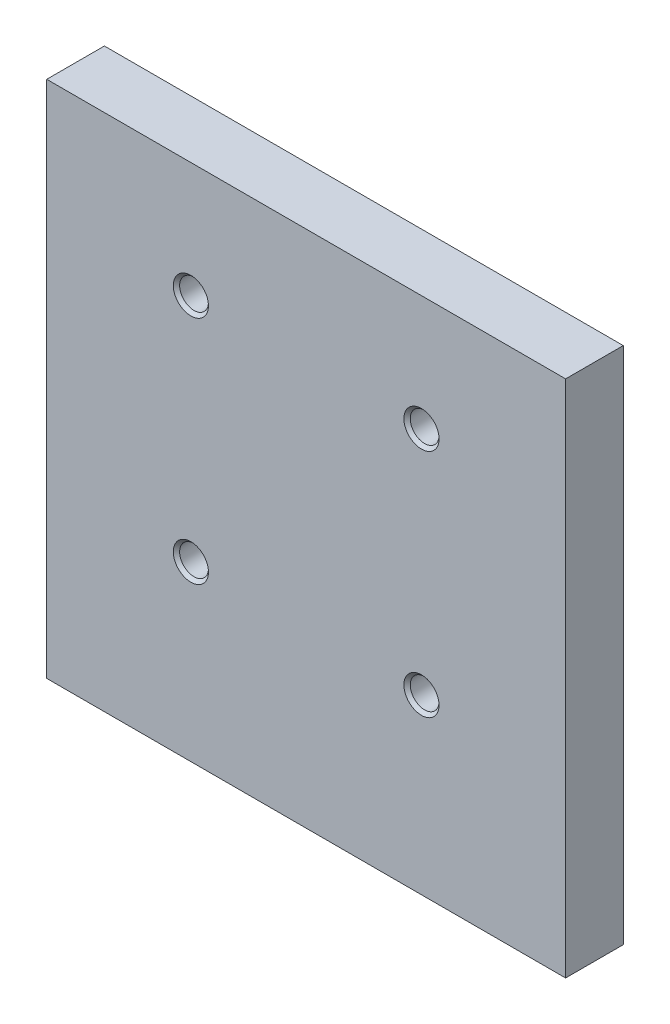
from build123d import *

# Parameters (mm, degrees)
SKETCH_1_W                   = 45
SKETCH_1_H                   = 45
EXTRUDE_1_DEPTH              = 5
HOLE_WIZARD_M3_3_D           = 2.5
HOLE_WIZARD_M3_3_CSINK_D     = 3.05
HOLE_WIZARD_M3_3_CSINK_ANGLE = 90


with BuildPart() as part:
    # 草图1 → 凸台-拉伸1 (new body)
    with BuildSketch(Plane.XY):
        with Locations((22.5, 22.5)):
            Rectangle(SKETCH_1_W, SKETCH_1_H)
    extrude(amount=EXTRUDE_1_DEPTH)

    # M3 螺纹孔3 (through all)
    with Locations(Plane.XY.offset(5)):
        with Locations((12.5, 35), (32.5, 35), (32.5, 15), (12.5, 15)):
            CounterSinkHole(HOLE_WIZARD_M3_3_D / 2, HOLE_WIZARD_M3_3_CSINK_D / 2, counter_sink_angle=HOLE_WIZARD_M3_3_CSINK_ANGLE)


solid = part.part
